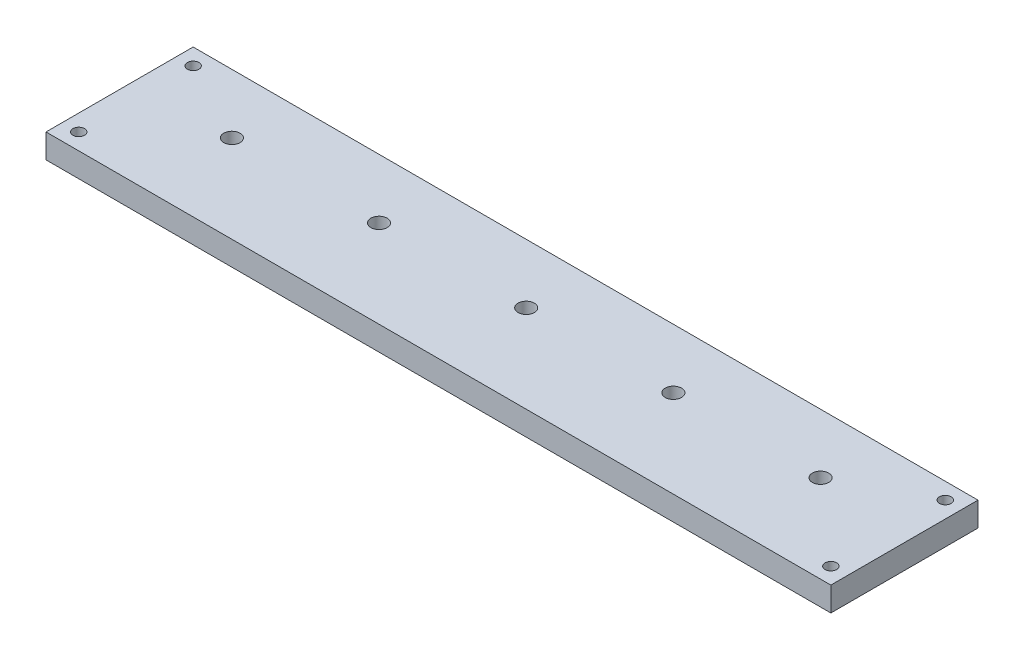
from build123d import *

# Parameters (mm, degrees)
SKETCH1_W             = 152.4
SKETCH1_H             = 28.575
SKETCH1_R             = 1.5875
BOSS_EXTRUDE1_DEPTH   = 4.699
SKETCH2_R             = 13.97
CUT_EXTRUDE1_DEPTH    = 1.778
F_4_40_TAPPED_HOLE1_D = 2.2606


with BuildPart() as part:
    # Sketch1 → Boss-Extrude1 (new body)
    with BuildSketch(Plane(origin=(0, 0, 0), x_dir=(1, 0, 0), z_dir=(0, 1, 0))):
        with Locations((76.2, 14.2875)):
            Rectangle(SKETCH1_W, SKETCH1_H)
        with Locations(Location((19.05, 17.0434, 0), (0, 0, 270))):
            Circle(SKETCH1_R, mode=Mode.SUBTRACT)
        with Locations(Location((47.625, 17.0434, 0), (0, 0, 270))):
            Circle(SKETCH1_R, mode=Mode.SUBTRACT)
        with Locations(Location((76.2, 17.0434, 0), (0, 0, 270))):
            Circle(SKETCH1_R, mode=Mode.SUBTRACT)
        with Locations(Location((104.775, 17.0434, 0), (0, 0, 270))):
            Circle(SKETCH1_R, mode=Mode.SUBTRACT)
        with Locations(Location((133.35, 17.0434, 0), (0, 0, 270))):
            Circle(SKETCH1_R, mode=Mode.SUBTRACT)
    extrude(amount=BOSS_EXTRUDE1_DEPTH)

    # Sketch2 → Cut-Extrude1 (cut)
    with BuildSketch(Plane.XZ):
        with Locations((19.05, -17.0434)):
            Circle(SKETCH2_R)
        with Locations((47.625, -17.0434)):
            Circle(SKETCH2_R)
        with Locations((76.2, -17.0434)):
            Circle(SKETCH2_R)
        with Locations((104.775, -17.0434)):
            Circle(SKETCH2_R)
        with Locations((133.35, -17.0434)):
            Circle(SKETCH2_R)
    extrude(amount=-CUT_EXTRUDE1_DEPTH, mode=Mode.SUBTRACT)

    # #4-40 Tapped Hole1 (through all)
    with Locations(Plane(origin=(0, 4.699, 0), x_dir=(1, 0, 0), z_dir=(0, 1, 0))):
        with Locations((3.175, 25.4), (3.175, 3.175), (149.225, 3.175), (149.225, 25.4)):
            Hole(F_4_40_TAPPED_HOLE1_D / 2)


solid = part.part
